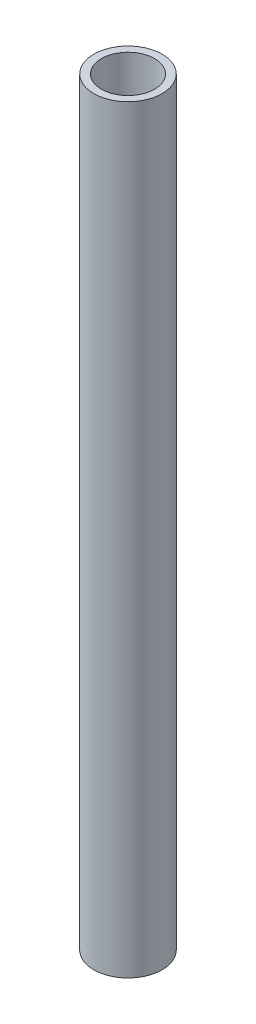
from build123d import *

# Parameters (mm, degrees)
SKETCH1_R           = 4.5
SKETCH1_R_2         = 3.5
BOSS_EXTRUDE1_DEPTH = 100


with BuildPart() as part:
    # Sketch1 → Boss-Extrude1 (new body)
    with BuildSketch(Plane(origin=(0, 0, 0), x_dir=(1, 0, 0), z_dir=(0, 1, 0))):
        with Locations(Location((0, 0, 0), (0, 0, 270))):
            Circle(SKETCH1_R)
        with Locations(Location((0, 0, 0), (0, 0, 270))):
            Circle(SKETCH1_R_2, mode=Mode.SUBTRACT)
    extrude(amount=BOSS_EXTRUDE1_DEPTH)


solid = part.part
